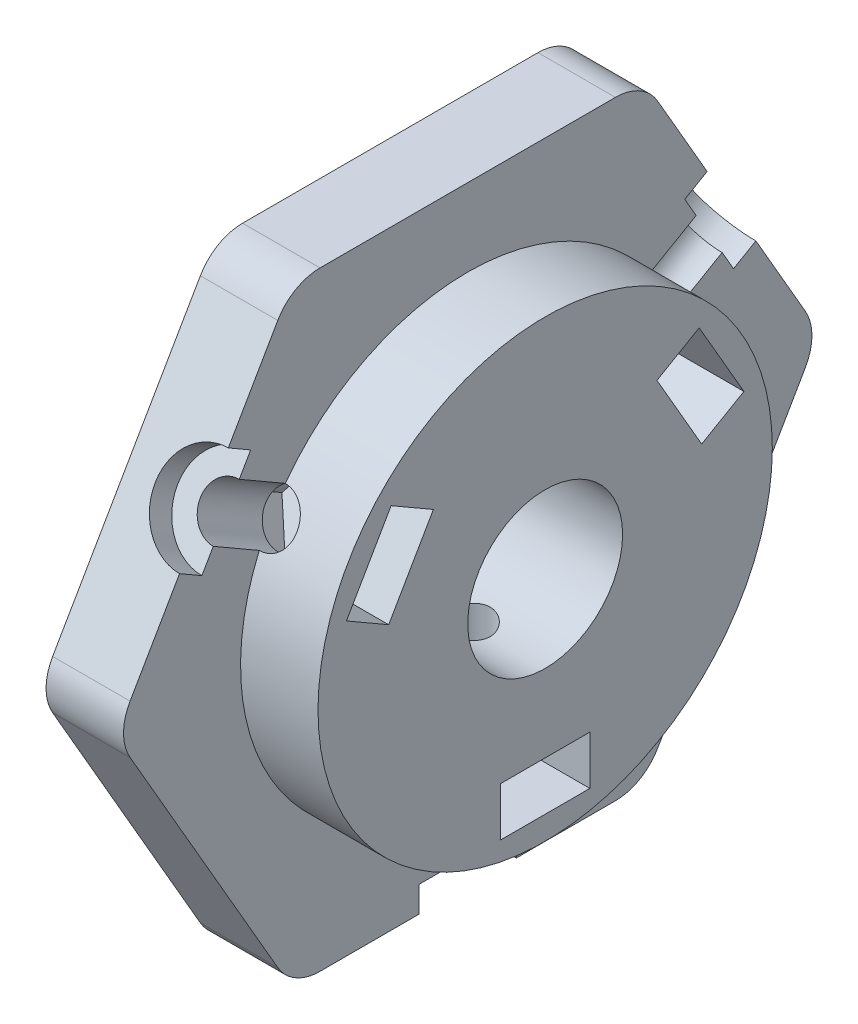
from build123d import *

# Parameters (mm, degrees)
BOSS_EXTRUDE1_DEPTH = 4.7625
SKETCH2_R           = 13.97
BOSS_EXTRUDE2_DEPTH = 4.7625
SKETCH3_R           = 3
CUT_EXTRUDE1_DEPTH  = 1.5875
CUT_EXTRUDE4_START  = 9.525
CUT_EXTRUDE4_DEPTH  = 3
CUT_EXTRUDE2_REACH  = 44.963
SKETCH4_R           = 1.6
SKETCH5_R           = 1.375
CUT_EXTRUDE3_DEPTH  = 12.7
CIRPATTERN3_COUNT   = 3
FILLET1_R           = 3
SKETCH7_R           = 4.7625
F_3_8IN_ROUND_DEPTH = 30.826926541


with BuildPart() as part:
    # Sketch1 → Boss-Extrude1 (new body)
    with BuildSketch(Plane(origin=(0, 0, 0), x_dir=(0, 0, -1), z_dir=(1, 0, 0))):
        Polygon((-10.815213918, 18.7325), (-21.630427835, 0), (-10.815213918, -18.7325), (10.815213918, -18.7325), (21.630427835, 0), (10.815213918, 18.7325), align=None)
    extrude(amount=BOSS_EXTRUDE1_DEPTH)

    # Sketch2 → Boss-Extrude2 (add)
    with BuildSketch(Plane(origin=(4.7625, 0, 0), x_dir=(0, 0, -1), z_dir=(1, 0, 0))):
        with Locations(Location((0, 0, 0), (0, 0, 180))):
            Circle(SKETCH2_R)
    extrude(amount=BOSS_EXTRUDE2_DEPTH)

    # Sketch3 → Cut-Extrude1 (cut)
    with BuildSketch(Plane.XZ.offset(18.7325)):
        with Locations((4.7625, 0)):
            Circle(SKETCH3_R)
    cut_extrude1 = extrude(amount=-CUT_EXTRUDE1_DEPTH, mode=Mode.SUBTRACT)

    # Sketch6 → Cut-Extrude4 (cut)
    with BuildSketch(Plane(origin=(0, 0, 0), x_dir=(-1, 0, 0), z_dir=(0, -1, 0)).offset(CUT_EXTRUDE4_START)):
        Polygon((-6.35021324, 2.75), (-9.525, 2.75), (-9.525, -2.75), (-6.35021324, -2.75), (-3.17478676, -2.75), (-1.587073519, 0), (-3.17478676, 2.75), align=None)
    cut_extrude4 = extrude(amount=CUT_EXTRUDE4_DEPTH, mode=Mode.SUBTRACT)

    # Cut-Extrude2: up to this face of the body (flat: up to its plane)
    cut_extrude2_end = Plane(part.part.faces().sort_by_distance((5.938262705, -9.525, 0))[0])
    # Sketch4 → Cut-Extrude2 (cut, up to the picked face)
    with BuildSketch(Plane.XZ.offset(17.145), mode=Mode.PRIVATE) as cut_extrude2_sk1:
        with Locations(Location((4.7625, 0, 0), (0, 0, 270))):
            Circle(SKETCH4_R)
    cut_extrude2_tool1 = split(extrude(cut_extrude2_sk1.sketch, amount=-CUT_EXTRUDE2_REACH, mode=Mode.PRIVATE), bisect_by=cut_extrude2_end, keep=Keep.BOTH, mode=Mode.PRIVATE)
    cut_extrude2 = cut_extrude2_tool1.solids().sort_by(Axis((4.7625, -17.145, 0), (0, 1, 0)))[0]
    add(cut_extrude2, mode=Mode.SUBTRACT)

    # Sketch5 → Cut-Extrude3 (cut)
    with BuildSketch(Plane.XZ.offset(17.145)):
        with Locations(Location((4.7625, 0, 0), (0, 0, 270))):
            Circle(SKETCH5_R)
    cut_extrude3 = extrude(amount=-CUT_EXTRUDE3_DEPTH, mode=Mode.SUBTRACT)

    # CirPattern3: Cut-Extrude1, Cut-Extrude4, Cut-Extrude2, Cut-Extrude3 ×3 about axis
    cirpattern3_axis = Axis((0, 0, 0), (1, 0, 0))
    add([cut_extrude1.rotate(cirpattern3_axis, i * 360 / CIRPATTERN3_COUNT) for i in range(1, CIRPATTERN3_COUNT)], mode=Mode.SUBTRACT)
    add([cut_extrude4.rotate(cirpattern3_axis, i * 360 / CIRPATTERN3_COUNT) for i in range(1, CIRPATTERN3_COUNT)], mode=Mode.SUBTRACT)
    add([cut_extrude2.rotate(cirpattern3_axis, i * 360 / CIRPATTERN3_COUNT) for i in range(1, CIRPATTERN3_COUNT)], mode=Mode.SUBTRACT)
    add([cut_extrude3.rotate(cirpattern3_axis, i * 360 / CIRPATTERN3_COUNT) for i in range(1, CIRPATTERN3_COUNT)], mode=Mode.SUBTRACT)

    # Fillet1
    fillet1_edges = [part.edges().sort_by_distance(p)[0] for p in [
        (2.38125, 18.7325, -10.815213918),
        (2.38125, 0, -21.630427835),
        (2.38125, -18.7325, -10.815213918),
        (2.38125, -18.7325, 10.815213918),
        (2.38125, 0, 21.630427835),
        (2.38125, 18.7325, 10.815213918),
    ]]
    fillet(fillet1_edges, radius=FILLET1_R)

    # Sketch7 → 3/8in Round (cut, through all)
    with BuildSketch(Plane(origin=(9.525, 0, 0), x_dir=(0, 0, -1), z_dir=(1, 0, 0))):
        Circle(SKETCH7_R)
    extrude(amount=-F_3_8IN_ROUND_DEPTH, mode=Mode.SUBTRACT)


solid = part.part
